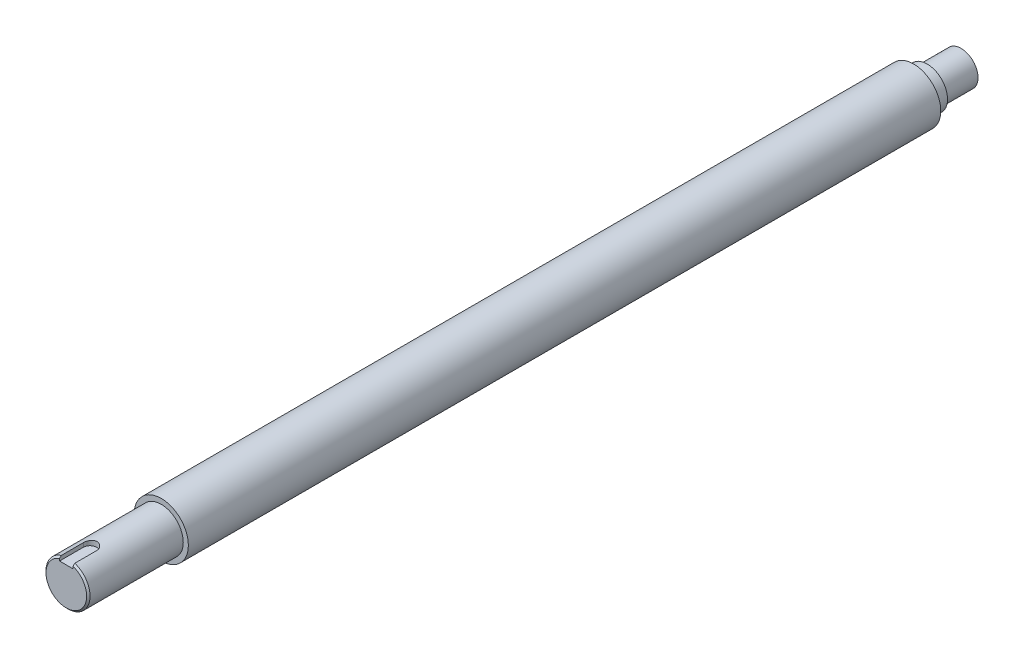
from build123d import *

# Parameters (mm, degrees)
SKETCH1_R           = 4
BOSS_EXTRUDE1_DEPTH = 66
SKETCH2_R           = 4
SKETCH2_R_2         = 3.25
CUT_EXTRUDE1_DEPTH  = 14
CUT_EXTRUDE2_DEPTH  = 1
CHAMFER1_SIZE       = 0.25
CUT_EXTRUDE3_START  = -7
SKETCH5_R           = 4
SKETCH5_R_2         = 3
CUT_EXTRUDE3_DEPTH  = 7
SKETCH7_R           = 3.566008396
SKETCH7_R_2         = 2.5
CUT_EXTRUDE4_DEPTH  = 5
CUT_EXTRUDE5_DEPTH  = 5


with BuildPart() as part:
    # Sketch1 → Boss-Extrude1 (new, symmetric)
    with BuildSketch(Plane.XY):
        Circle(SKETCH1_R)
    extrude(amount=BOSS_EXTRUDE1_DEPTH, both=True)

    # Sketch2 → Cut-Extrude1 (cut)
    with BuildSketch(Plane.XY.offset(66)):
        Circle(SKETCH2_R)
        Circle(SKETCH2_R_2, mode=Mode.SUBTRACT)
    extrude(amount=-CUT_EXTRUDE1_DEPTH, mode=Mode.SUBTRACT)

    # Sketch3 → Cut-Extrude2 (cut)
    with BuildSketch(Plane(origin=(0, 3.5, 0), x_dir=(1, 0, 0), z_dir=(0, 1, 0))):
        with BuildLine():
            Line((1, -62.5), (1, -66))
            ThreePointArc((1, -66), (0, -67), (-1, -66))
            Line((-1, -66), (-1, -62.5))
            ThreePointArc((-1, -62.5), (0, -61.5), (1, -62.5))
        make_face()
    extrude(amount=-CUT_EXTRUDE2_DEPTH, mode=Mode.SUBTRACT)

    # Chamfer1
    chamfer1_edges = [part.edges().sort_by_distance(p)[0] for p in [
        (-1.912132318, -2.627974505, 66),
    ]]
    chamfer(chamfer1_edges, length=CHAMFER1_SIZE)

    # Sketch5 → Cut-Extrude3 (cut)
    with BuildSketch(Plane(origin=(0, 0, -66), x_dir=(-1, 0, 0), z_dir=(0, 0, -1)).offset(CUT_EXTRUDE3_START)):
        Circle(SKETCH5_R)
        Circle(SKETCH5_R_2, mode=Mode.SUBTRACT)
    extrude(amount=CUT_EXTRUDE3_DEPTH, mode=Mode.SUBTRACT)

    # Sketch7 → Cut-Extrude4 (cut)
    with BuildSketch(Plane(origin=(0, 0, -66), x_dir=(-1, 0, 0), z_dir=(0, 0, -1))):
        Circle(SKETCH7_R)
        Circle(SKETCH7_R_2, mode=Mode.SUBTRACT)
    extrude(amount=-CUT_EXTRUDE4_DEPTH, mode=Mode.SUBTRACT)

    # Sketch8 → Cut-Extrude5 (cut)
    with BuildSketch(Plane(origin=(0, 0, -66), x_dir=(-1, 0, 0), z_dir=(0, 0, -1))):
        Polygon((0.75, -1.299038106), (1.5, 0), (0.75, 1.299038106), (-0.75, 1.299038106), (-1.5, 0), (-0.75, -1.299038106), align=None)
    extrude(amount=-CUT_EXTRUDE5_DEPTH, mode=Mode.SUBTRACT)


solid = part.part
